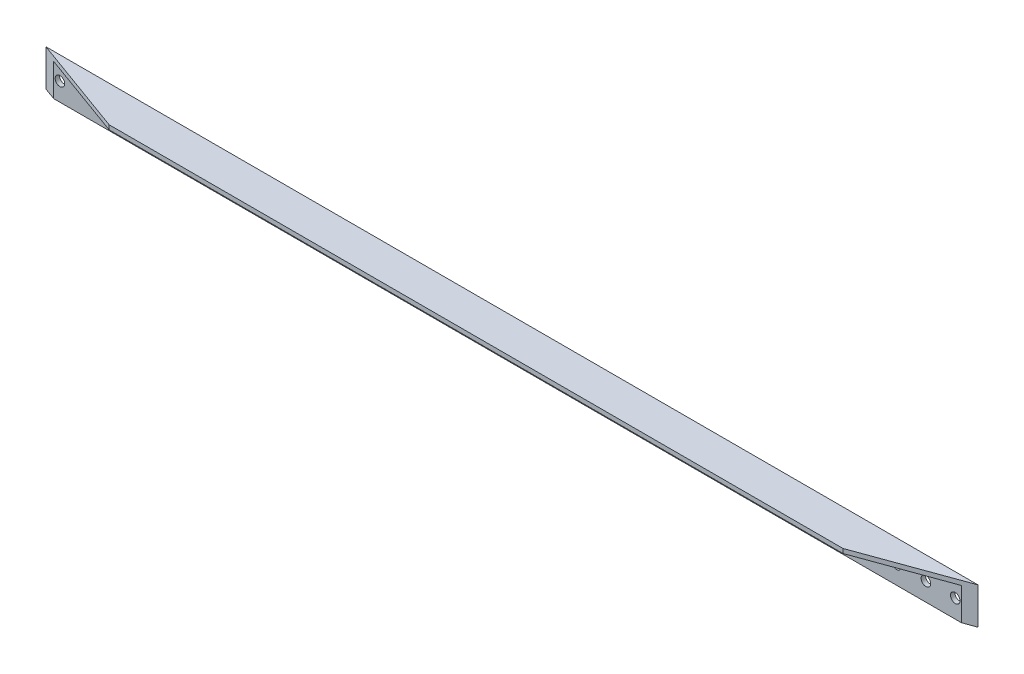
from build123d import *

# Parameters (mm, degrees)
SKETCH_1_W          = 2540
SKETCH_1_H          = 100
SKETCH_1_R          = 13
EXTRUDE_525_DEPTH   = 12
SKETCH_2_W          = 2540
SKETCH_2_H          = 12
EXTRUDE_1_DEPTH     = 86
CUT_EXTRUDE_1_DEPTH = 1278.694799238


with BuildPart() as part:
    # 草图1 → Extrude 525 (new body)
    with BuildSketch(Plane.XY):
        Rectangle(SKETCH_1_W, SKETCH_1_H)
        with Locations((1220, 0)):
            Circle(SKETCH_1_R, mode=Mode.SUBTRACT)
        with Locations((1140, 0)):
            Circle(SKETCH_1_R, mode=Mode.SUBTRACT)
        with Locations((1060, 0)):
            Circle(SKETCH_1_R, mode=Mode.SUBTRACT)
        with Locations((980, 0)):
            Circle(SKETCH_1_R, mode=Mode.SUBTRACT)
        with Locations((580, 0)):
            Circle(SKETCH_1_R, mode=Mode.SUBTRACT)
        with Locations((460, 0)):
            Circle(SKETCH_1_R, mode=Mode.SUBTRACT)
        with Locations((380, 0)):
            Circle(SKETCH_1_R, mode=Mode.SUBTRACT)
        with Locations((300, 0)):
            Circle(SKETCH_1_R, mode=Mode.SUBTRACT)
        with Locations((180, 0)):
            Circle(SKETCH_1_R, mode=Mode.SUBTRACT)
        with Locations(Location((-180, 0, 0), (0, 0, 180))):
            Circle(SKETCH_1_R, mode=Mode.SUBTRACT)
        with Locations(Location((-300, 0, 0), (0, 0, 180))):
            Circle(SKETCH_1_R, mode=Mode.SUBTRACT)
        with Locations(Location((-380, 0, 0), (0, 0, 180))):
            Circle(SKETCH_1_R, mode=Mode.SUBTRACT)
        with Locations(Location((-460, 0, 0), (0, 0, 180))):
            Circle(SKETCH_1_R, mode=Mode.SUBTRACT)
        with Locations(Location((-580, 0, 0), (0, 0, 180))):
            Circle(SKETCH_1_R, mode=Mode.SUBTRACT)
        with Locations(Location((-980, 0, 0), (0, 0, 180))):
            Circle(SKETCH_1_R, mode=Mode.SUBTRACT)
        with Locations(Location((-1060, 0, 0), (0, 0, 180))):
            Circle(SKETCH_1_R, mode=Mode.SUBTRACT)
        with Locations(Location((-1140, 0, 0), (0, 0, 180))):
            Circle(SKETCH_1_R, mode=Mode.SUBTRACT)
        with Locations(Location((-1220, 0, 0), (0, 0, 180))):
            Circle(SKETCH_1_R, mode=Mode.SUBTRACT)
    extrude(amount=EXTRUDE_525_DEPTH)

    # 草图2 → 凸台-拉伸1 (add)
    with BuildSketch(Plane.XY.offset(12)):
        with Locations((0, 44)):
            Rectangle(SKETCH_2_W, SKETCH_2_H)
    extrude(amount=EXTRUDE_1_DEPTH)

    # 草图4 → 切除-拉伸1 (cut, through all)
    with BuildSketch(Plane(origin=(0, 50, 0), x_dir=(-1, 0, 0), z_dir=(0, 1, 0))):
        Polygon((-1270, 0), (-1270, 98), (-1000, 98), align=None)
        Polygon((1270, 0), (1000, 98), (1270, 98), align=None)
    extrude(amount=-CUT_EXTRUDE_1_DEPTH, mode=Mode.SUBTRACT)


solid = part.part
